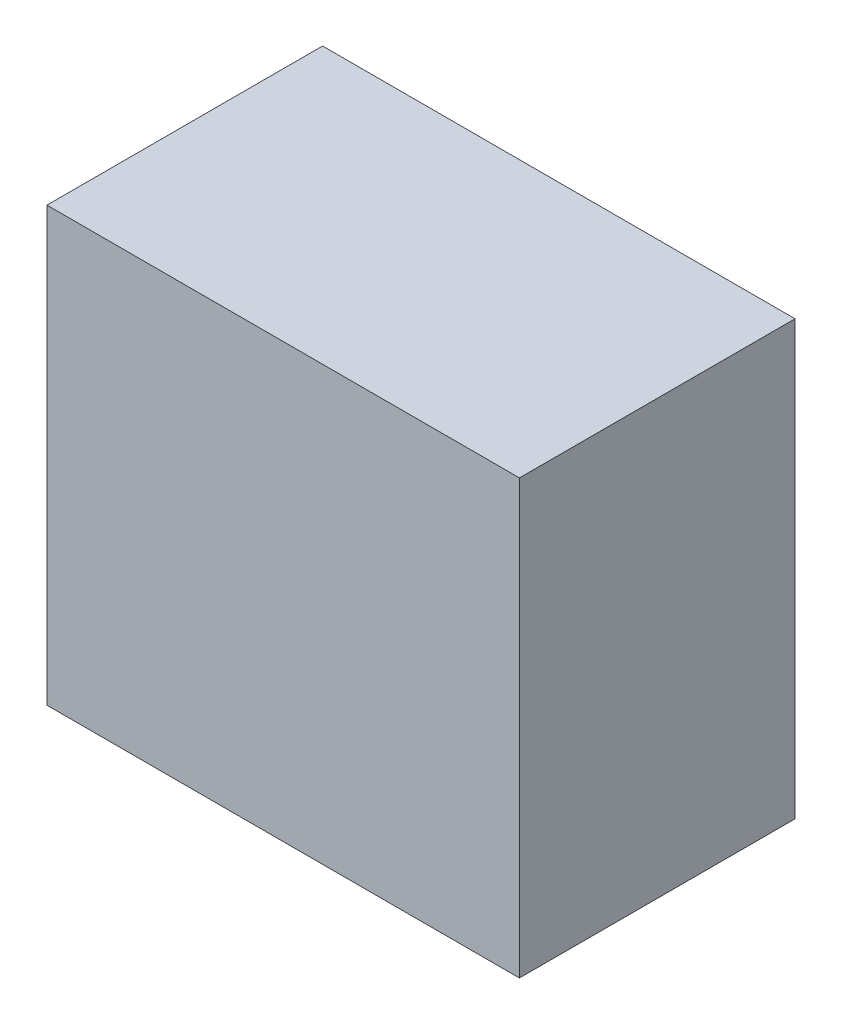
from build123d import *

# Parameters (mm, degrees)
SKETCH1_W           = 304.8
SKETCH1_H           = 279.4
BOSS_EXTRUDE1_DEPTH = 177.8


with BuildPart() as part:
    # Sketch1 → Boss-Extrude1 (new body)
    with BuildSketch(Plane.XY):
        Rectangle(SKETCH1_W, SKETCH1_H)
    extrude(amount=BOSS_EXTRUDE1_DEPTH)


solid = part.part
